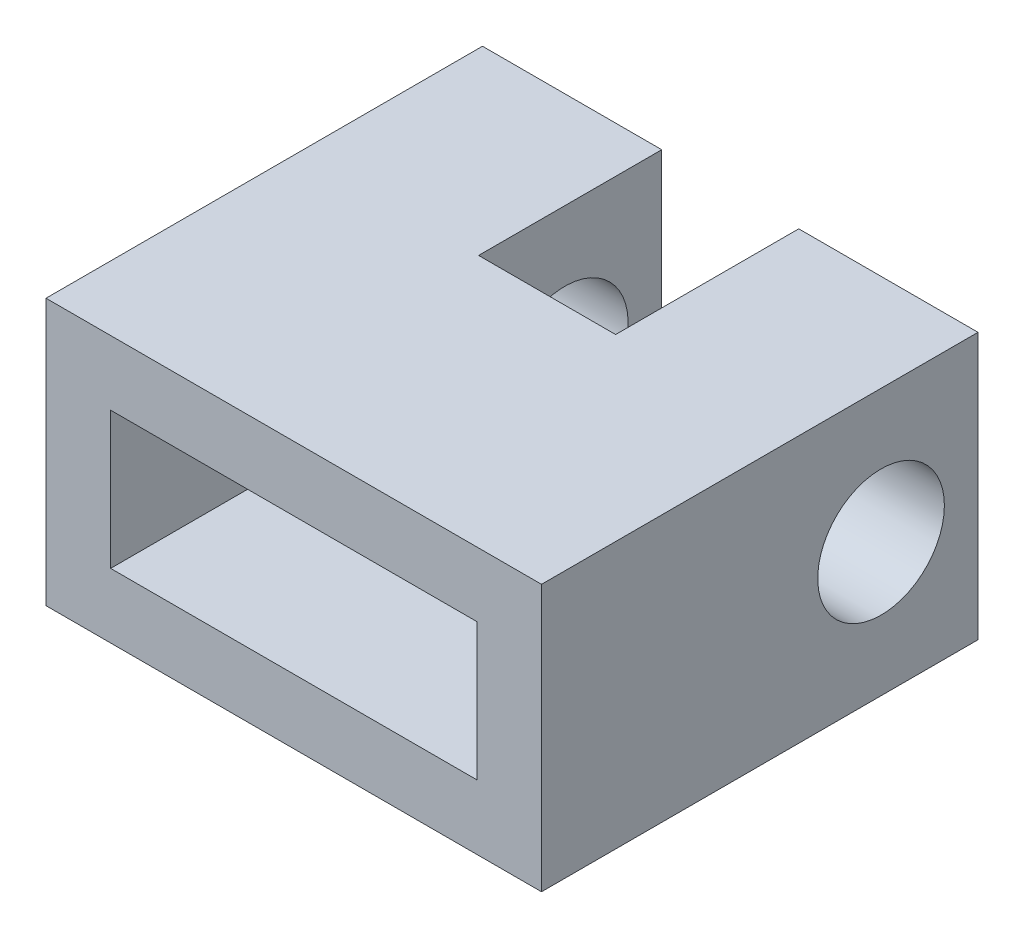
from build123d import *

# Parameters (mm, degrees)
SKETCH1_W           = 11.5
SKETCH1_H           = 6.18
SKETCH1_W_2         = 8.5
SKETCH1_H_2         = 3.18
BOSS_EXTRUDE1_DEPTH = 4.88
SKETCH2_W           = 11.5
SKETCH2_H           = 6.18
BOSS_EXTRUDE2_DEPTH = 1
SKETCH3_W           = 4.16
SKETCH3_H           = 6.18
BOSS_EXTRUDE3_DEPTH = 4.25
SKETCH4_R           = 1.47
CUT_EXTRUDE1_DEPTH  = 7.5
SKETCH5_R           = 1.47
CUT_EXTRUDE2_DEPTH  = 14.480166913


with BuildPart() as part:
    # Sketch1 → Boss-Extrude1 (new body)
    with BuildSketch(Plane.XY):
        with Locations((4.25, 1.59)):
            Rectangle(SKETCH1_W, SKETCH1_H)
        with Locations((4.25, 1.59)):
            Rectangle(SKETCH1_W_2, SKETCH1_H_2, mode=Mode.SUBTRACT)
    extrude(amount=BOSS_EXTRUDE1_DEPTH)

    # Sketch2 → Boss-Extrude2 (add)
    with BuildSketch(Plane(origin=(0, 0, 0), x_dir=(-1, 0, 0), z_dir=(0, 0, -1))):
        with Locations((-4.25, 1.59)):
            Rectangle(SKETCH2_W, SKETCH2_H)
    extrude(amount=BOSS_EXTRUDE2_DEPTH)

    # Sketch3 → Boss-Extrude3 (add)
    with BuildSketch(Plane(origin=(0, 0, -1), x_dir=(-1, 0, 0), z_dir=(0, 0, -1))):
        with Locations((-7.92, 1.59)):
            Rectangle(SKETCH3_W, SKETCH3_H)
        with Locations((-0.58, 1.59)):
            Rectangle(SKETCH3_W, SKETCH3_H)
    extrude(amount=BOSS_EXTRUDE3_DEPTH)

    # Sketch4 → Cut-Extrude1 (cut)
    with BuildSketch(Plane(origin=(10, 0, 0), x_dir=(0, 0, -1), z_dir=(1, 0, 0))):
        with Locations((3, 1.59)):
            Circle(SKETCH4_R)
    extrude(amount=-CUT_EXTRUDE1_DEPTH, mode=Mode.SUBTRACT)

    # Sketch5 → Cut-Extrude2 (cut, through all)
    with BuildSketch(Plane.ZY.offset(1.5)):
        with Locations(Location((-3, 1.59, 0), (0, 0, 270))):
            Circle(SKETCH5_R)
    extrude(amount=-CUT_EXTRUDE2_DEPTH, mode=Mode.SUBTRACT)


solid = part.part
